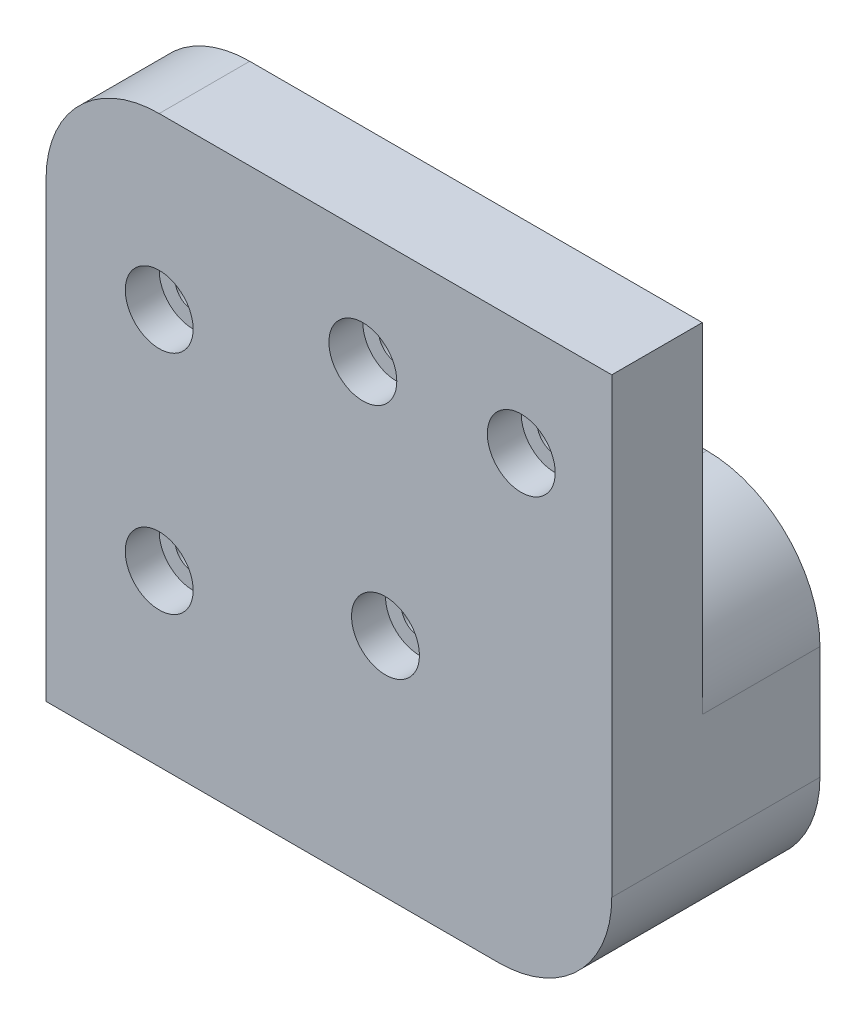
from build123d import *

# Parameters (mm, degrees)
SKETCH_1_R          = 1.6
EXTRUDE_1_DEPTH     = 8
SKETCH_2_R          = 3
CUT_EXTRUDE_1_DEPTH = 3
FILLET_1_R          = 10
EXTRUDE_START       = -18.399949
SKETCH_3_R          = 1.6
EXTRUDE_2_DEPTH     = 18.399949
SKETCH_5_R          = 3
CUT_EXTRUDE_2_DEPTH = 3
FILLET_2_R          = 10


with BuildPart() as part:
    # 草图1 → 凸台-拉伸1 (new body)
    with BuildSketch(Plane.XY):
        Polygon((10, 57.5), (10, 27.5), (-10, 27.5), (-10, 77.5), (40, 77.5), (40, 57.5), align=None)
        with Locations((32, 67.5)):
            Circle(SKETCH_1_R, mode=Mode.SUBTRACT)
        with Locations((18, 67.5)):
            Circle(SKETCH_1_R, mode=Mode.SUBTRACT)
        with Locations((0, 62.5)):
            Circle(SKETCH_1_R, mode=Mode.SUBTRACT)
        with Locations((0, 42.5)):
            Circle(SKETCH_1_R, mode=Mode.SUBTRACT)
    extrude(amount=EXTRUDE_1_DEPTH)

    # 草图2 → 切除-拉伸1 (cut)
    with BuildSketch(Plane.XY.offset(8)):
        with Locations((32, 67.5)):
            Circle(SKETCH_2_R)
        with Locations((18, 67.5)):
            Circle(SKETCH_2_R)
        with Locations((0, 62.5)):
            Circle(SKETCH_2_R)
        with Locations((0, 42.5)):
            Circle(SKETCH_2_R)
    extrude(amount=-CUT_EXTRUDE_1_DEPTH, mode=Mode.SUBTRACT)

    # 圆角1
    fillet_1_edges = [part.edges().sort_by_distance(p)[0] for p in [
        (-10, 77.5, 4),
        (10, 57.5, 4),
    ]]
    fillet(fillet_1_edges, radius=FILLET_1_R)

    # 草图3 → 凸台-拉伸2 (add)
    with BuildSketch(Plane.XY.offset(8).offset(EXTRUDE_START)):
        with BuildLine():
            Line((40, 27.5), (40, 57.5))
            Line((40, 57.5), (20, 57.5))
            ThreePointArc((20, 57.5), (12.939135643, 54.581256565), (10.000041584, 47.528838907))
            ThreePointArc((10.000041584, 47.528838907), (10.000010396, 47.514419468), (10, 47.5))
            Line((10, 47.5), (10, 27.5))
            Line((10, 27.5), (40, 27.5))
        make_face()
        with Locations((20, 47.528839027)):
            Circle(SKETCH_3_R, mode=Mode.SUBTRACT)
    extrude(amount=EXTRUDE_2_DEPTH)

    # 草图5 → 切除-拉伸2 (cut)
    with BuildSketch(Plane.XY.offset(8)):
        with Locations((20, 47.528839027)):
            Circle(SKETCH_5_R)
    extrude(amount=-CUT_EXTRUDE_2_DEPTH, mode=Mode.SUBTRACT)

    # 圆角2
    fillet_2_edges = [part.edges().sort_by_distance(p)[0] for p in [
        (40, 57.5, -5.1999745),
        (10, 27.5, -5.1999745),
        (40, 27.5, -1.1999745),
    ]]
    fillet(fillet_2_edges, radius=FILLET_2_R)


solid = part.part
